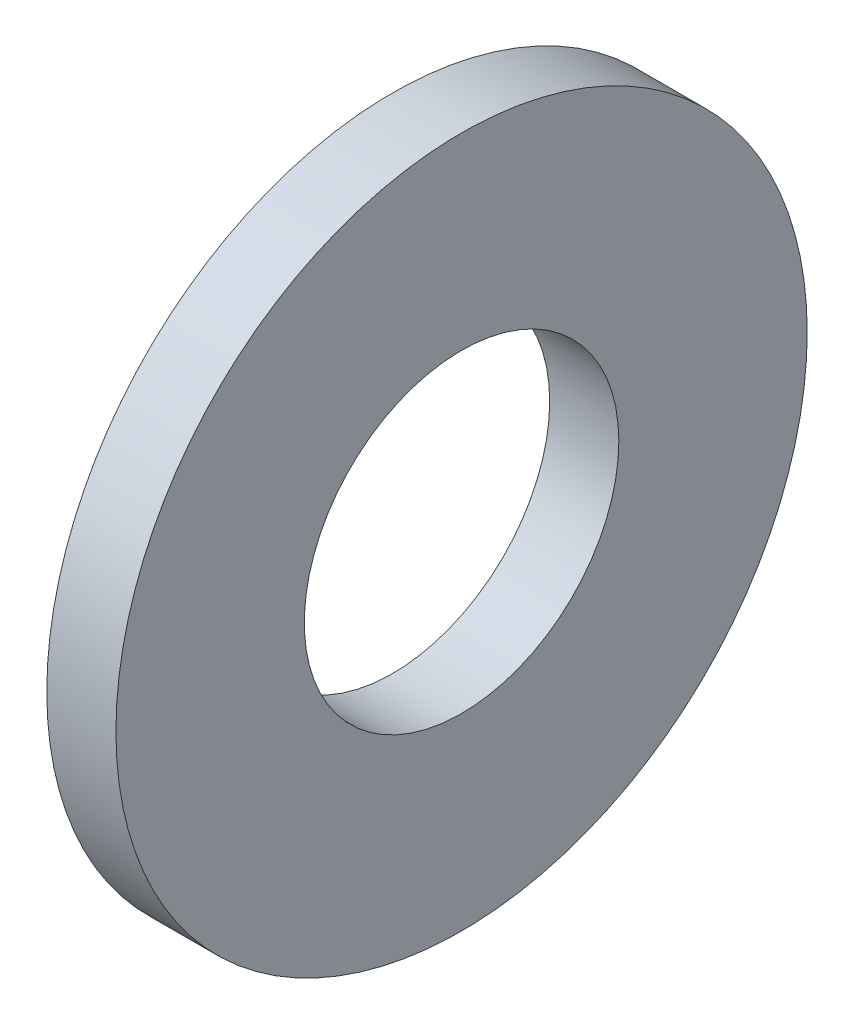
from build123d import *

# Parameters (mm, degrees)
SKETCH1_R          = 5
SKETCH1_R_2        = 2.275
BASE_EXTRUDE_DEPTH = 1


with BuildPart() as part:
    # Sketch1 → Base-Extrude (new body)
    with BuildSketch(Plane(origin=(0, 0, 0), x_dir=(0, 0, -1), z_dir=(1, 0, 0))):
        Circle(SKETCH1_R)
        Circle(SKETCH1_R_2, mode=Mode.SUBTRACT)
    extrude(amount=BASE_EXTRUDE_DEPTH)


solid = part.part
